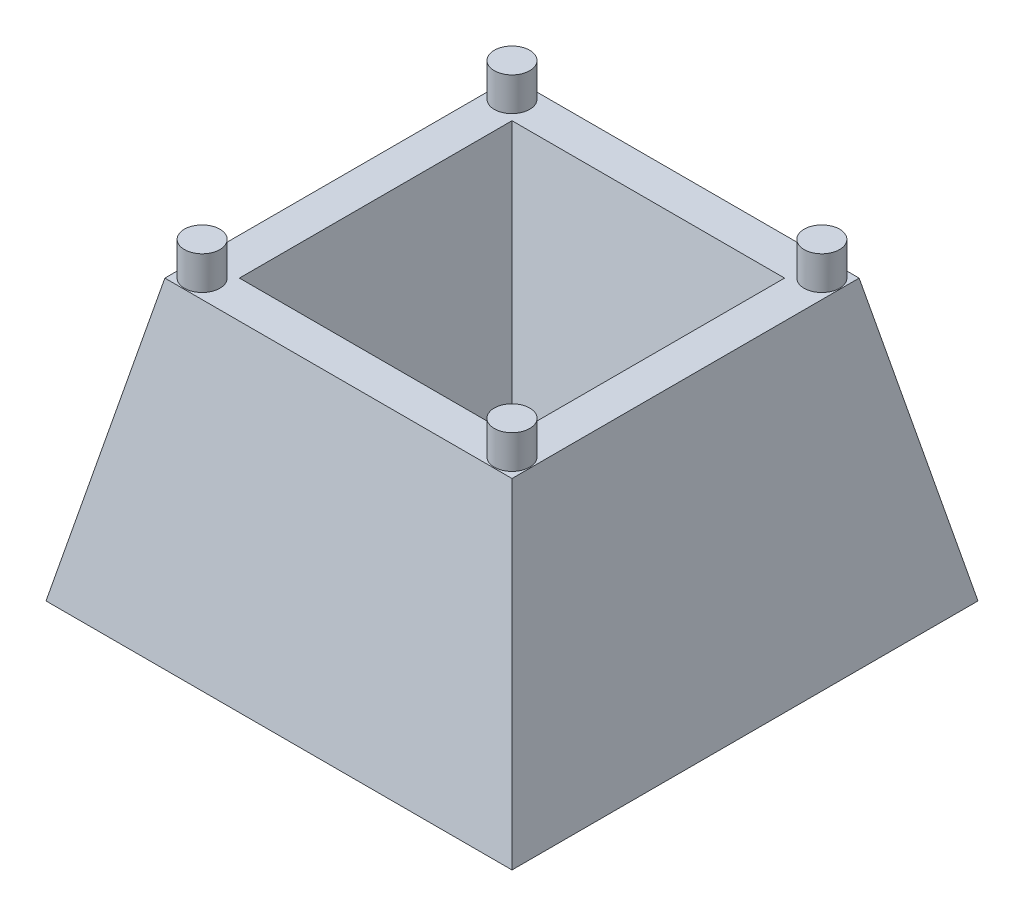
from build123d import *

# Parameters (mm, degrees)
SKETCH4_W                     = 25
SKETCH4_H                     = 25
BASE_DEPTH                    = 15
BASE_TAPER                    = 12
SKETCH5_W                     = 14.62330315
SKETCH5_H                     = 14.62330315
RESERVOIR_DEPTH               = 12
RESERVOIR_DRAFT               = -12
SKETCH1_R                     = 0.75
PILLARS_DEPTH                 = 1.5
PILLARS_DRAFT                 = 12
PILLARS_PROFILE_2_DEPTH       = 1.5
PILLARS_PROFILE_2_DRAFT       = 12
PILLARS_PROFILE_3_DEPTH       = 1.5
PILLARS_PROFILE_3_DRAFT       = 12
PILLARS_PROFILE_4_DEPTH       = 1.5
PILLARS_PROFILE_4_DRAFT       = 12
PILLARS_PROFILE_5_DEPTH       = 1.5
PILLARS_PROFILE_5_DRAFT       = 12
PILLARS_PROFILE_6_DEPTH       = 1.5
PILLARS_PROFILE_6_DRAFT       = 12
PILLARS_PROFILE_7_DEPTH       = 1.5
PILLARS_PROFILE_7_DRAFT       = 12
PILLARS_PROFILE_8_DEPTH       = 1.5
PILLARS_PROFILE_8_DRAFT       = 12
PILLARS_PROFILE_9_DEPTH       = 1.5
PILLARS_PROFILE_9_DRAFT       = 12
PILLARS_PROFILE_10_DEPTH      = 1.5
PILLARS_PROFILE_10_DRAFT      = 12
CHANNEL_WALLS_DEPTH           = 0.5
CHANNEL_WALLS_DRAFT           = 12
CHANNEL_WALLS_PROFILE_2_DEPTH = 0.5
CHANNEL_WALLS_PROFILE_2_DRAFT = 12
SKETCH11_R                    = 0.95
PEGS_DEPTH                    = 1.8


with BuildPart() as part:
    # Sketch4 → Base (new body)
    with BuildSketch(Plane(origin=(0, 0, 0), x_dir=(1, 0, 0), z_dir=(0, 1, 0))):
        Rectangle(SKETCH4_W, SKETCH4_H)
    extrude(amount=BASE_DEPTH, taper=BASE_TAPER)


with BuildPart() as reservoir_tool:
    # Sketch5 → Reservoir (with draft: the straight prism first)
    with BuildSketch(Plane(origin=(0, 15, 0), x_dir=(1, 0, 0), z_dir=(0, 1, 0))):
        Rectangle(SKETCH5_W, SKETCH5_H)
    extrude(amount=-RESERVOIR_DEPTH)
    # Reservoir: the draft: its side faces are tilted about the plane it starts from
    reservoir_sides = [reservoir_tool.faces().sort_by_distance(p)[0] for p in [
        (-7.311651575, 9, 0),
        (0, 9, 7.311651575),
        (7.311651575, 9, 0),
        (0, 9, -7.311651575),
    ]]
    draft(reservoir_sides, Plane(origin=(0, 15, 0), x_dir=(1, 0, 0), z_dir=(0, 1, 0)), RESERVOIR_DRAFT)


with BuildPart() as part_1:
    add(part.part)

    # Reservoir: cut by reservoir_tool
    add(reservoir_tool.part, mode=Mode.SUBTRACT)


with BuildPart() as pillars_tool:
    # Sketch1 → Pillars (with draft: the straight prism first)
    with BuildSketch(Plane(origin=(0, 3, 0), x_dir=(1, 0, 0), z_dir=(0, 1, 0))):
        with Locations((-3.78, 0)):
            Circle(SKETCH1_R)
    extrude(amount=PILLARS_DEPTH)
    # Pillars: the draft: its side faces are tilted about the plane it starts from
    pillars_sides = [pillars_tool.faces().sort_by_distance(p)[0] for p in [
        (-4.53, 3.75, 0),
    ]]
    draft(pillars_sides, Plane(origin=(0, 3, 0), x_dir=(1, 0, 0), z_dir=(0, 1, 0)), PILLARS_DRAFT)


with BuildPart() as part_2:
    add(part_1.part)

    # Pillars: add pillars_tool
    add(pillars_tool.part)


with BuildPart() as pillars_profile_2_tool:
    # Sketch1 → Pillars profile 2 (with draft: the straight prism first)
    with BuildSketch(Plane(origin=(0, 3, 0), x_dir=(1, 0, 0), z_dir=(0, 1, 0))):
        with Locations((3.78, 0)):
            Circle(SKETCH1_R)
    extrude(amount=PILLARS_PROFILE_2_DEPTH)
    # Pillars profile 2: the draft: its side faces are tilted about the plane it starts from
    pillars_profile_2_sides = [pillars_profile_2_tool.faces().sort_by_distance(p)[0] for p in [
        (3.03, 3.75, 0),
    ]]
    draft(pillars_profile_2_sides, Plane(origin=(0, 3, 0), x_dir=(1, 0, 0), z_dir=(0, 1, 0)), PILLARS_PROFILE_2_DRAFT)


with BuildPart() as part_3:
    add(part_2.part)

    # Pillars profile 2: add pillars_profile_2_tool
    add(pillars_profile_2_tool.part)


with BuildPart() as pillars_profile_3_tool:
    # Sketch1 → Pillars profile 3 (with draft: the straight prism first)
    with BuildSketch(Plane(origin=(0, 3, 0), x_dir=(1, 0, 0), z_dir=(0, 1, 0))):
        with Locations((2.93, 1.75)):
            Circle(SKETCH1_R)
    extrude(amount=PILLARS_PROFILE_3_DEPTH)
    # Pillars profile 3: the draft: its side faces are tilted about the plane it starts from
    pillars_profile_3_sides = [pillars_profile_3_tool.faces().sort_by_distance(p)[0] for p in [
        (2.18, 3.75, -1.75),
    ]]
    draft(pillars_profile_3_sides, Plane(origin=(0, 3, 0), x_dir=(1, 0, 0), z_dir=(0, 1, 0)), PILLARS_PROFILE_3_DRAFT)


with BuildPart() as part_4:
    add(part_3.part)

    # Pillars profile 3: add pillars_profile_3_tool
    add(pillars_profile_3_tool.part)


with BuildPart() as pillars_profile_4_tool:
    # Sketch1 → Pillars profile 4 (with draft: the straight prism first)
    with BuildSketch(Plane(origin=(0, 3, 0), x_dir=(1, 0, 0), z_dir=(0, 1, 0))):
        with Locations((2.93, -1.75)):
            Circle(SKETCH1_R)
    extrude(amount=PILLARS_PROFILE_4_DEPTH)
    # Pillars profile 4: the draft: its side faces are tilted about the plane it starts from
    pillars_profile_4_sides = [pillars_profile_4_tool.faces().sort_by_distance(p)[0] for p in [
        (2.18, 3.75, 1.75),
    ]]
    draft(pillars_profile_4_sides, Plane(origin=(0, 3, 0), x_dir=(1, 0, 0), z_dir=(0, 1, 0)), PILLARS_PROFILE_4_DRAFT)


with BuildPart() as part_5:
    add(part_4.part)

    # Pillars profile 4: add pillars_profile_4_tool
    add(pillars_profile_4_tool.part)


with BuildPart() as pillars_profile_5_tool:
    # Sketch1 → Pillars profile 5 (with draft: the straight prism first)
    with BuildSketch(Plane(origin=(0, 3, 0), x_dir=(1, 0, 0), z_dir=(0, 1, 0))):
        with Locations((-2.93, -1.75)):
            Circle(SKETCH1_R)
    extrude(amount=PILLARS_PROFILE_5_DEPTH)
    # Pillars profile 5: the draft: its side faces are tilted about the plane it starts from
    pillars_profile_5_sides = [pillars_profile_5_tool.faces().sort_by_distance(p)[0] for p in [
        (-3.68, 3.75, 1.75),
    ]]
    draft(pillars_profile_5_sides, Plane(origin=(0, 3, 0), x_dir=(1, 0, 0), z_dir=(0, 1, 0)), PILLARS_PROFILE_5_DRAFT)


with BuildPart() as part_6:
    add(part_5.part)

    # Pillars profile 5: add pillars_profile_5_tool
    add(pillars_profile_5_tool.part)


with BuildPart() as pillars_profile_6_tool:
    # Sketch1 → Pillars profile 6 (with draft: the straight prism first)
    with BuildSketch(Plane(origin=(0, 3, 0), x_dir=(1, 0, 0), z_dir=(0, 1, 0))):
        with Locations((-2.93, 1.75)):
            Circle(SKETCH1_R)
    extrude(amount=PILLARS_PROFILE_6_DEPTH)
    # Pillars profile 6: the draft: its side faces are tilted about the plane it starts from
    pillars_profile_6_sides = [pillars_profile_6_tool.faces().sort_by_distance(p)[0] for p in [
        (-3.68, 3.75, -1.75),
    ]]
    draft(pillars_profile_6_sides, Plane(origin=(0, 3, 0), x_dir=(1, 0, 0), z_dir=(0, 1, 0)), PILLARS_PROFILE_6_DRAFT)


with BuildPart() as part_7:
    add(part_6.part)

    # Pillars profile 6: add pillars_profile_6_tool
    add(pillars_profile_6_tool.part)


with BuildPart() as pillars_profile_7_tool:
    # Sketch1 → Pillars profile 7 (with draft: the straight prism first)
    with BuildSketch(Plane(origin=(0, 3, 0), x_dir=(1, 0, 0), z_dir=(0, 1, 0))):
        with Locations((1.03, 2)):
            Circle(SKETCH1_R)
    extrude(amount=PILLARS_PROFILE_7_DEPTH)
    # Pillars profile 7: the draft: its side faces are tilted about the plane it starts from
    pillars_profile_7_sides = [pillars_profile_7_tool.faces().sort_by_distance(p)[0] for p in [
        (0.28, 3.75, -2),
    ]]
    draft(pillars_profile_7_sides, Plane(origin=(0, 3, 0), x_dir=(1, 0, 0), z_dir=(0, 1, 0)), PILLARS_PROFILE_7_DRAFT)


with BuildPart() as part_8:
    add(part_7.part)

    # Pillars profile 7: add pillars_profile_7_tool
    add(pillars_profile_7_tool.part)


with BuildPart() as pillars_profile_8_tool:
    # Sketch1 → Pillars profile 8 (with draft: the straight prism first)
    with BuildSketch(Plane(origin=(0, 3, 0), x_dir=(1, 0, 0), z_dir=(0, 1, 0))):
        with Locations((1.03, -2)):
            Circle(SKETCH1_R)
    extrude(amount=PILLARS_PROFILE_8_DEPTH)
    # Pillars profile 8: the draft: its side faces are tilted about the plane it starts from
    pillars_profile_8_sides = [pillars_profile_8_tool.faces().sort_by_distance(p)[0] for p in [
        (0.28, 3.75, 2),
    ]]
    draft(pillars_profile_8_sides, Plane(origin=(0, 3, 0), x_dir=(1, 0, 0), z_dir=(0, 1, 0)), PILLARS_PROFILE_8_DRAFT)


with BuildPart() as part_9:
    add(part_8.part)

    # Pillars profile 8: add pillars_profile_8_tool
    add(pillars_profile_8_tool.part)


with BuildPart() as pillars_profile_9_tool:
    # Sketch1 → Pillars profile 9 (with draft: the straight prism first)
    with BuildSketch(Plane(origin=(0, 3, 0), x_dir=(1, 0, 0), z_dir=(0, 1, 0))):
        with Locations((-1.03, 2)):
            Circle(SKETCH1_R)
    extrude(amount=PILLARS_PROFILE_9_DEPTH)
    # Pillars profile 9: the draft: its side faces are tilted about the plane it starts from
    pillars_profile_9_sides = [pillars_profile_9_tool.faces().sort_by_distance(p)[0] for p in [
        (-1.78, 3.75, -2),
    ]]
    draft(pillars_profile_9_sides, Plane(origin=(0, 3, 0), x_dir=(1, 0, 0), z_dir=(0, 1, 0)), PILLARS_PROFILE_9_DRAFT)


with BuildPart() as part_10:
    add(part_9.part)

    # Pillars profile 9: add pillars_profile_9_tool
    add(pillars_profile_9_tool.part)


with BuildPart() as pillars_profile_10_tool:
    # Sketch1 → Pillars profile 10 (with draft: the straight prism first)
    with BuildSketch(Plane(origin=(0, 3, 0), x_dir=(1, 0, 0), z_dir=(0, 1, 0))):
        with Locations((-1.03, -2)):
            Circle(SKETCH1_R)
    extrude(amount=PILLARS_PROFILE_10_DEPTH)
    # Pillars profile 10: the draft: its side faces are tilted about the plane it starts from
    pillars_profile_10_sides = [pillars_profile_10_tool.faces().sort_by_distance(p)[0] for p in [
        (-1.78, 3.75, 2),
    ]]
    draft(pillars_profile_10_sides, Plane(origin=(0, 3, 0), x_dir=(1, 0, 0), z_dir=(0, 1, 0)), PILLARS_PROFILE_10_DRAFT)


with BuildPart() as part_11:
    add(part_10.part)

    # Pillars profile 10: add pillars_profile_10_tool
    add(pillars_profile_10_tool.part)


with BuildPart() as channel_walls_tool:
    # Sketch1<10> → Channel Walls (with draft: the straight prism first)
    with BuildSketch(Plane(origin=(0, 3, 0), x_dir=(1, 0, 0), z_dir=(0, 1, 0))):
        with BuildLine():
            Line((-0.871410162, 0.545096189), (-0.672168784, 0.2))
            ThreePointArc((-0.672168784, 0.2), (-0.580662433, 0.108493649), (-0.455662433, 0.075))
            Line((-0.455662433, 0.075), (0.455662433, 0.075))
            ThreePointArc((0.455662433, 0.075), (0.580662433, 0.108493649), (0.672168784, 0.2))
            Line((0.672168784, 0.2), (0.871410162, 0.545096189))
            ThreePointArc((0.871410162, 0.545096189), (0.902765026, 0.702727737), (0.831680506, 0.846872885))
            Line((0.831680506, 0.846872885), (0.176776695, 1.501776695))
            ThreePointArc((0.176776695, 1.501776695), (0, 1.575), (-0.176776695, 1.501776695))
            Line((-0.176776695, 1.501776695), (-0.831680506, 0.846872885))
            ThreePointArc((-0.831680506, 0.846872885), (-0.902765026, 0.702727737), (-0.871410162, 0.545096189))
        make_face()
    extrude(amount=CHANNEL_WALLS_DEPTH)
    # Channel Walls: the draft: its side faces are tilted about the plane it starts from
    channel_walls_sides = [channel_walls_tool.faces().sort_by_distance(p)[0] for p in [
        (-0.771789473, 3.25, -0.372548095),
        (-0.580662433, 3.25, -0.108493649),
        (0, 3.25, -0.075),
        (0.580662433, 3.25, -0.108493649),
        (0.771789473, 3.25, -0.372548095),
        (0.902765026, 3.25, -0.702727737),
        (0.504228601, 3.25, -1.17432479),
        (0, 3.25, -1.575),
        (-0.504228601, 3.25, -1.17432479),
        (-0.902765026, 3.25, -0.702727737),
    ]]
    draft(channel_walls_sides, Plane(origin=(0, 3, 0), x_dir=(1, 0, 0), z_dir=(0, 1, 0)), CHANNEL_WALLS_DRAFT)


with BuildPart() as part_12:
    add(part_11.part)

    # Channel Walls: add channel_walls_tool
    add(channel_walls_tool.part)


with BuildPart() as channel_walls_profile_2_tool:
    # Sketch1<10> → Channel Walls profile 2 (with draft: the straight prism first)
    with BuildSketch(Plane(origin=(0, 3, 0), x_dir=(1, 0, 0), z_dir=(0, 1, 0))):
        with BuildLine():
            Line((0.871410162, -0.545096189), (0.672168784, -0.2))
            ThreePointArc((0.672168784, -0.2), (0.580662433, -0.108493649), (0.455662433, -0.075))
            Line((0.455662433, -0.075), (-0.455662433, -0.075))
            ThreePointArc((-0.455662433, -0.075), (-0.580662433, -0.108493649), (-0.672168784, -0.2))
            Line((-0.672168784, -0.2), (-0.871410162, -0.545096189))
            ThreePointArc((-0.871410162, -0.545096189), (-0.902765026, -0.702727737), (-0.831680506, -0.846872885))
            Line((-0.831680506, -0.846872885), (-0.176776695, -1.501776695))
            ThreePointArc((-0.176776695, -1.501776695), (0, -1.575), (0.176776695, -1.501776695))
            Line((0.176776695, -1.501776695), (0.831680506, -0.846872885))
            ThreePointArc((0.831680506, -0.846872885), (0.902765026, -0.702727737), (0.871410162, -0.545096189))
        make_face()
    extrude(amount=CHANNEL_WALLS_PROFILE_2_DEPTH)
    # Channel Walls profile 2: the draft: its side faces are tilted about the plane it starts from
    channel_walls_profile_2_sides = [channel_walls_profile_2_tool.faces().sort_by_distance(p)[0] for p in [
        (0.771789473, 3.25, 0.372548095),
        (0.580662433, 3.25, 0.108493649),
        (0, 3.25, 0.075),
        (-0.580662433, 3.25, 0.108493649),
        (-0.771789473, 3.25, 0.372548095),
        (-0.902765026, 3.25, 0.702727737),
        (-0.504228601, 3.25, 1.17432479),
        (0, 3.25, 1.575),
        (0.504228601, 3.25, 1.17432479),
        (0.902765026, 3.25, 0.702727737),
    ]]
    draft(channel_walls_profile_2_sides, Plane(origin=(0, 3, 0), x_dir=(1, 0, 0), z_dir=(0, 1, 0)), CHANNEL_WALLS_PROFILE_2_DRAFT)


with BuildPart() as part_13:
    add(part_12.part)

    # Channel Walls profile 2: add channel_walls_profile_2_tool
    add(channel_walls_profile_2_tool.part)

    # Sketch11 → Pegs (add)
    with BuildSketch(Plane(origin=(0, 15, 0), x_dir=(1, 0, 0), z_dir=(0, 1, 0))):
        with Locations((8.311651575, 8.311651575)):
            Circle(SKETCH11_R)
        with Locations((-8.311651575, 8.311651575)):
            Circle(SKETCH11_R)
        with Locations((-8.311651575, -8.311651575)):
            Circle(SKETCH11_R)
        with Locations((8.311651575, -8.311651575)):
            Circle(SKETCH11_R)
    extrude(amount=PEGS_DEPTH)


solid = part_13.part
